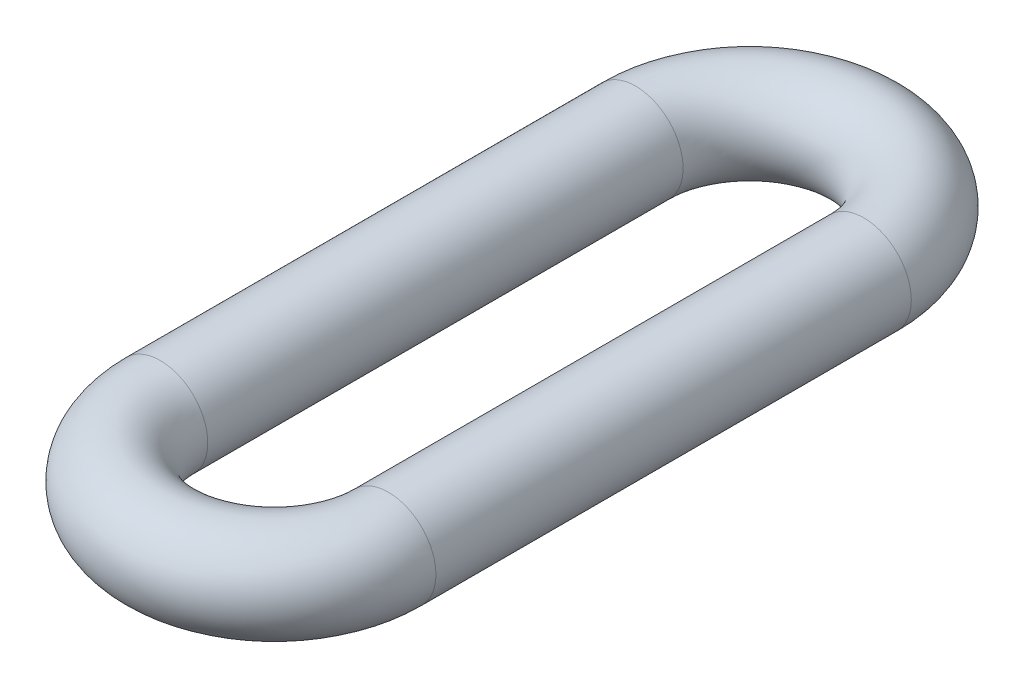
from build123d import *

# Parameters (mm, degrees)
SKETCH1_R   = 50
SKETCH1_R_2 = 40


with BuildPart() as part:
    # Sweep1: sweep along a path in Sketch2
    with BuildLine(Plane(origin=(0, 0, 0), x_dir=(1, 0, 0), z_dir=(0, 1, 0))) as sweep1_path:
        Line((0, 0), (0, 500))
        ThreePointArc((0, 500), (120, 620), (240, 500))
        Line((240, 500), (240, 0))
        ThreePointArc((240, 0), (120, -120), (0, 0))
    # Sketch1 → Sweep1 (sweep)
    with BuildSketch(Plane.XY):
        Circle(SKETCH1_R)
        Circle(SKETCH1_R_2, mode=Mode.SUBTRACT)
    sweep(path=sweep1_path.line)


solid = part.part
